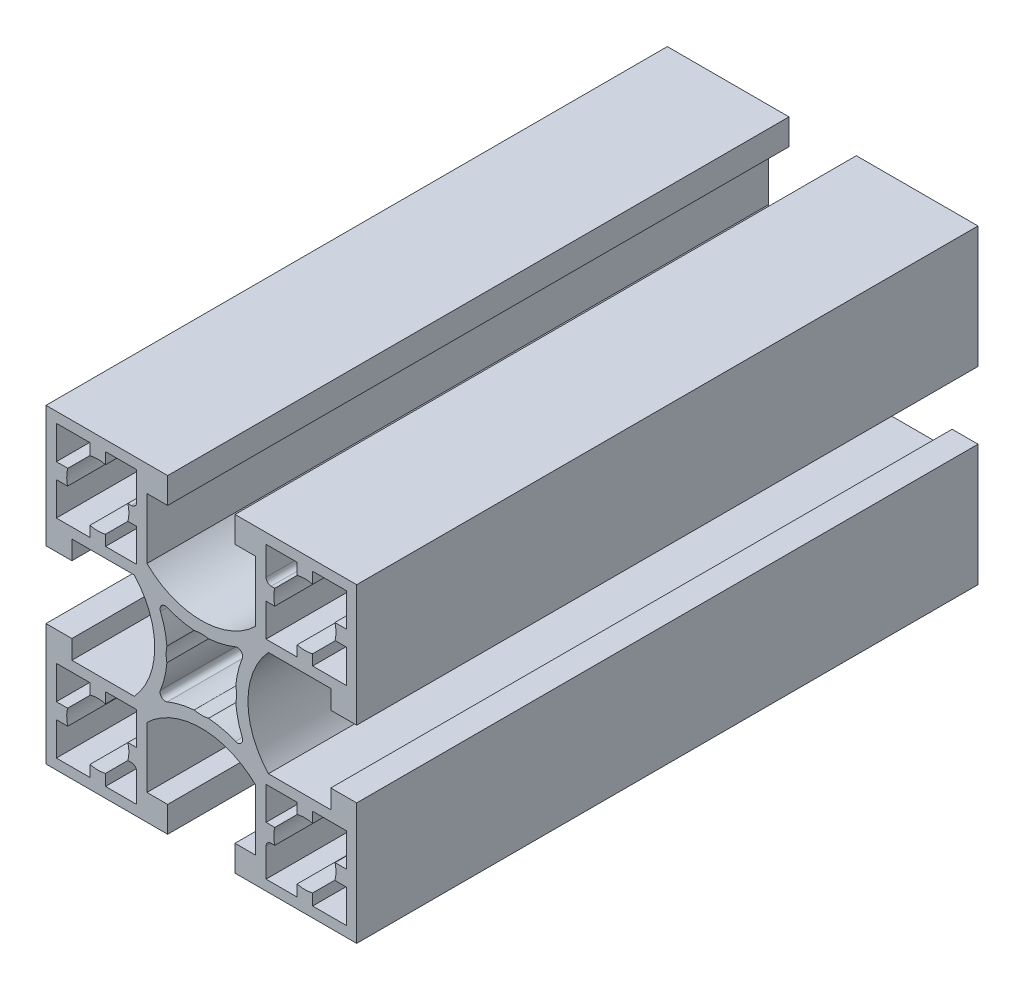
from build123d import *

# Parameters (mm, degrees)
EXTRUDE_1_DEPTH = 30


with BuildPart() as part:
    # 草圖1 → 擠出1 (new, symmetric)
    with BuildSketch(Plane.XY):
        with BuildLine():
            Line((-15, -3.25), (-12.5, -3.25))
            Line((-12.5, -3.25), (-12.5, -5.072439755))
            Line((-12.5, -5.072439755), (-6.47547695, -5.072439755))
            ThreePointArc((-6.47547695, -5.072439755), (-4.5, 0), (-6.47547695, 5.072439755))
            Line((-6.47547695, 5.072439755), (-12.5, 5.072439755))
            Line((-12.5, 5.072439755), (-12.5, 3.25))
            Line((-12.5, 3.25), (-15, 3.25))
            Line((-15, 3.25), (-15, 15))
            Line((-15, 15), (-3.25, 15))
            Line((-3.25, 15), (-3.25, 12.5))
            Line((-3.25, 12.5), (-5.25, 12.5))
            Line((-5.25, 12.5), (-5.25, 6.643928679))
            ThreePointArc((-5.25, 6.643928679), (0, 4.5), (5.25, 6.643928679))
            Line((5.25, 6.643928679), (5.25, 12.5))
            Line((5.25, 12.5), (3.25, 12.5))
            Line((3.25, 12.5), (3.25, 15))
            Line((3.25, 15), (15, 15))
            Line((15, 15), (15, 3.25))
            Line((15, 3.25), (12.5, 3.25))
            Line((12.5, 3.25), (12.5, 5.072439755))
            Line((12.5, 5.072439755), (6.47547695, 5.072439755))
            ThreePointArc((6.47547695, 5.072439755), (4.5, 0), (6.47547695, -5.072439755))
            Line((6.47547695, -5.072439755), (12.5, -5.072439755))
            Line((12.5, -5.072439755), (12.5, -3.25))
            Line((12.5, -3.25), (15, -3.25))
            Line((15, -3.25), (15, -15))
            Line((15, -15), (3.25, -15))
            Line((3.25, -15), (3.25, -12.5))
            Line((3.25, -12.5), (5.25, -12.5))
            Line((5.25, -12.5), (5.25, -6.643928679))
            ThreePointArc((5.25, -6.643928679), (0, -4.5), (-5.25, -6.643928679))
            Line((-5.25, -6.643928679), (-5.25, -12.5))
            Line((-5.25, -12.5), (-3.25, -12.5))
            Line((-3.25, -12.5), (-3.25, -15))
            Line((-3.25, -15), (-15, -15))
            Line((-15, -15), (-15, -3.25))
        make_face()
        with BuildLine():
            Line((-9.25, -6.072439755), (-6.25, -6.072439755))
            Line((-6.25, -6.072439755), (-6.25, -9.25))
            Line((-6.25, -9.25), (-7.09526249, -9.25))
            ThreePointArc((-7.09526249, -9.25), (-7, -10), (-7.09526249, -10.75))
            Line((-7.09526249, -10.75), (-6.75, -10.75))
            ThreePointArc((-6.75, -10.75), (-6.396446609, -10.896446609), (-6.25, -11.25))
            Line((-6.25, -11.25), (-6.25, -14))
            Line((-6.25, -14), (-9.25, -14))
            Line((-9.25, -14), (-9.25, -12.90473751))
            ThreePointArc((-9.25, -12.90473751), (-10, -13), (-10.75, -12.90473751))
            Line((-10.75, -12.90473751), (-10.75, -14))
            Line((-10.75, -14), (-14, -14))
            Line((-14, -14), (-14, -10.786219878))
            Line((-14, -10.786219878), (-12.895143918, -10.786219878))
            ThreePointArc((-12.895143918, -10.786219878), (-12.999766765, -10.037407923), (-12.913849333, -9.286219878))
            Line((-12.913849333, -9.286219878), (-14, -9.286219878))
            Line((-14, -9.286219878), (-14, -6.072439755))
            Line((-14, -6.072439755), (-10.75, -6.072439755))
            Line((-10.75, -6.072439755), (-10.75, -7.09526249))
            ThreePointArc((-10.75, -7.09526249), (-10, -7), (-9.25, -7.09526249))
            Line((-9.25, -7.09526249), (-9.25, -6.072439755))
        make_face(mode=Mode.SUBTRACT)
        with BuildLine():
            Line((-14, 6.072439755), (-10.75, 6.072439755))
            Line((-10.75, 6.072439755), (-10.75, 7.09526249))
            ThreePointArc((-10.75, 7.09526249), (-10, 7), (-9.25, 7.09526249))
            Line((-9.25, 7.09526249), (-9.25, 6.072439755))
            Line((-9.25, 6.072439755), (-6.25, 6.072439755))
            Line((-6.25, 6.072439755), (-6.25, 9.25))
            Line((-6.25, 9.25), (-7.09526249, 9.25))
            ThreePointArc((-7.09526249, 9.25), (-7, 10), (-7.09526249, 10.75))
            Line((-7.09526249, 10.75), (-6.75, 10.75))
            ThreePointArc((-6.75, 10.75), (-6.396446609, 10.896446609), (-6.25, 11.25))
            Line((-6.25, 11.25), (-6.25, 14))
            Line((-6.25, 14), (-9.25, 14))
            Line((-9.25, 14), (-9.25, 12.90473751))
            ThreePointArc((-9.25, 12.90473751), (-10, 13), (-10.75, 12.90473751))
            Line((-10.75, 12.90473751), (-10.75, 14))
            Line((-10.75, 14), (-14, 14))
            Line((-14, 14), (-14, 10.786219878))
            Line((-14, 10.786219878), (-12.895143918, 10.786219878))
            ThreePointArc((-12.895143918, 10.786219878), (-12.999766765, 10.037407923), (-12.913849333, 9.286219878))
            Line((-12.913849333, 9.286219878), (-14, 9.286219878))
            Line((-14, 9.286219878), (-14, 6.072439755))
        make_face(mode=Mode.SUBTRACT)
        with BuildLine():
            Line((14, 14), (14, 10.786219878))
            Line((14, 10.786219878), (12.895143918, 10.786219878))
            ThreePointArc((12.895143918, 10.786219878), (12.999766765, 10.037407923), (12.913849333, 9.286219878))
            Line((12.913849333, 9.286219878), (14, 9.286219878))
            Line((14, 9.286219878), (14, 6.072439755))
            Line((14, 6.072439755), (10.75, 6.072439755))
            Line((10.75, 6.072439755), (10.75, 7.09526249))
            ThreePointArc((10.75, 7.09526249), (10, 7), (9.25, 7.09526249))
            Line((9.25, 7.09526249), (9.25, 6.072439755))
            Line((9.25, 6.072439755), (6.25, 6.072439755))
            Line((6.25, 6.072439755), (6.25, 9.25))
            Line((6.25, 9.25), (7.09526249, 9.25))
            ThreePointArc((7.09526249, 9.25), (7, 10), (7.09526249, 10.75))
            Line((7.09526249, 10.75), (6.75, 10.75))
            ThreePointArc((6.75, 10.75), (6.396446609, 10.896446609), (6.25, 11.25))
            Line((6.25, 11.25), (6.25, 14))
            Line((6.25, 14), (9.25, 14))
            Line((9.25, 14), (9.25, 12.90473751))
            ThreePointArc((9.25, 12.90473751), (10, 13), (10.75, 12.90473751))
            Line((10.75, 12.90473751), (10.75, 14))
            Line((10.75, 14), (14, 14))
        make_face(mode=Mode.SUBTRACT)
        with BuildLine():
            Line((7.09526249, -10.75), (6.75, -10.75))
            ThreePointArc((6.75, -10.75), (6.396446609, -10.896446609), (6.25, -11.25))
            Line((6.25, -11.25), (6.25, -14))
            Line((6.25, -14), (9.25, -14))
            Line((9.25, -14), (9.25, -12.90473751))
            ThreePointArc((9.25, -12.90473751), (10, -13), (10.75, -12.90473751))
            Line((10.75, -12.90473751), (10.75, -14))
            Line((10.75, -14), (14, -14))
            Line((14, -14), (14, -10.786219878))
            Line((14, -10.786219878), (12.895143918, -10.786219878))
            ThreePointArc((12.895143918, -10.786219878), (12.999766765, -10.037407923), (12.913849333, -9.286219878))
            Line((12.913849333, -9.286219878), (14, -9.286219878))
            Line((14, -9.286219878), (14, -6.072439755))
            Line((14, -6.072439755), (10.75, -6.072439755))
            Line((10.75, -6.072439755), (10.75, -7.09526249))
            ThreePointArc((10.75, -7.09526249), (10, -7), (9.25, -7.09526249))
            Line((9.25, -7.09526249), (9.25, -6.072439755))
            Line((9.25, -6.072439755), (6.25, -6.072439755))
            Line((6.25, -6.072439755), (6.25, -9.25))
            Line((6.25, -9.25), (7.09526249, -9.25))
            ThreePointArc((7.09526249, -9.25), (7, -10), (7.09526249, -10.75))
        make_face(mode=Mode.SUBTRACT)
        with BuildLine():
            ThreePointArc((3.948754255, 3.296580342), (3.537868444, 2.020477551), (3.327916667, 0.696398348))
            ThreePointArc((3.327916667, 0.696398348), (3.4, 0), (3.327916667, -0.696398348))
            ThreePointArc((3.327916667, -0.696398348), (3.537868444, -2.020477551), (3.948754255, -3.296580342))
            ThreePointArc((3.948754255, -3.296580342), (3.839592373, -3.839592373), (3.296580342, -3.948754255))
            ThreePointArc((3.296580342, -3.948754255), (2.020477551, -3.537868444), (0.696398348, -3.327916667))
            ThreePointArc((0.696398348, -3.327916667), (0, -3.4), (-0.696398348, -3.327916667))
            ThreePointArc((-0.696398348, -3.327916667), (-2.020477551, -3.537868444), (-3.296580342, -3.948754255))
            ThreePointArc((-3.296580342, -3.948754255), (-3.839592373, -3.839592373), (-3.948754255, -3.296580342))
            ThreePointArc((-3.948754255, -3.296580342), (-3.537868444, -2.020477551), (-3.327916667, -0.696398348))
            ThreePointArc((-3.327916667, -0.696398348), (-3.4, 0), (-3.327916667, 0.696398348))
            ThreePointArc((-3.327916667, 0.696398348), (-3.537868444, 2.020477551), (-3.948754255, 3.296580342))
            ThreePointArc((-3.948754255, 3.296580342), (-3.839592373, 3.839592373), (-3.296580342, 3.948754255))
            ThreePointArc((-3.296580342, 3.948754255), (-2.020477551, 3.537868444), (-0.696398348, 3.327916667))
            ThreePointArc((-0.696398348, 3.327916667), (0, 3.4), (0.696398348, 3.327916667))
            ThreePointArc((0.696398348, 3.327916667), (2.020477551, 3.537868444), (3.296580342, 3.948754255))
            ThreePointArc((3.296580342, 3.948754255), (3.839592373, 3.839592373), (3.948754255, 3.296580342))
        make_face(mode=Mode.SUBTRACT)
    extrude(amount=EXTRUDE_1_DEPTH, both=True)


solid = part.part
